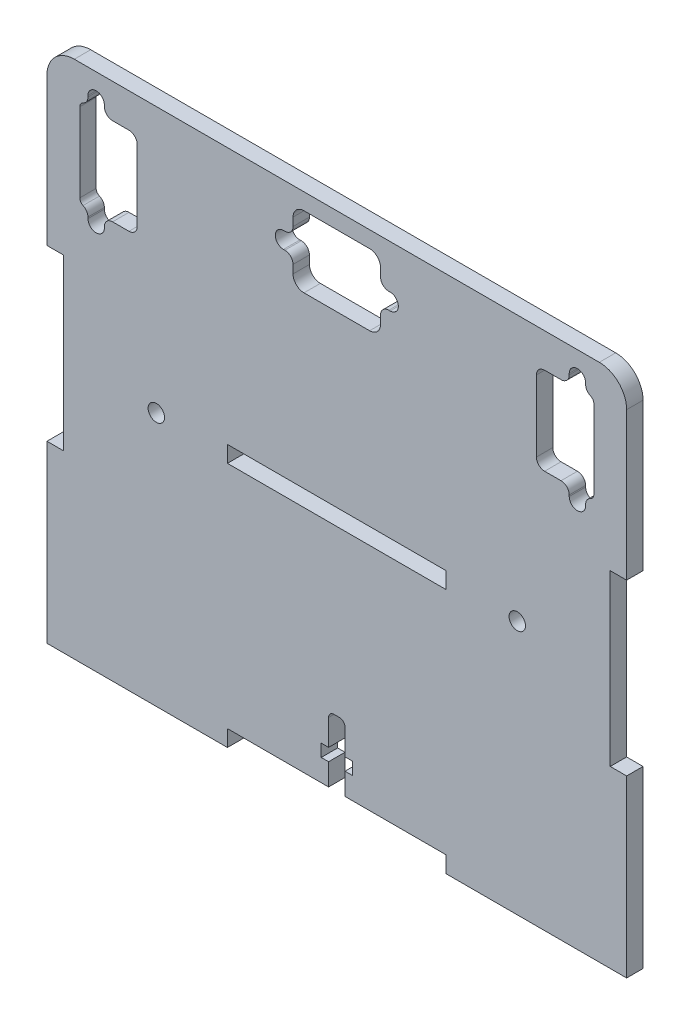
from build123d import *

# Parameters (mm, degrees)
ESBO_O1_W                = 100
ESBO_O1_H                = 95
RESSALTO_EXTRUS_O1_DEPTH = 1.5
ESBO_O2_R                = 1.5
ESBO_O2_W                = 40
ESBO_O2_H                = 3
CORTE_EXTRUS_O1_DEPTH    = 70.030790232
ESBO_O3_W                = 3
ESBO_O3_H                = 32
RESSALTO_EXTRUS_O2_DEPTH = 3
CUT_EXTRUDE1_DEPTH       = 72.233770081
CUT_EXTRUDE1_DEPTH_BACK  = 72.233770081
CUT_EXTRUDE4_DEPTH       = 72.186375101
CUT_EXTRUDE4_DEPTH_BACK  = 72.186375101
FILLET1_R                = 5


with BuildPart() as part:
    # Esboço1 → Ressalto-extrusão1 (new, symmetric)
    with BuildSketch(Plane.XY):
        Rectangle(ESBO_O1_W, ESBO_O1_H)
    extrude(amount=RESSALTO_EXTRUS_O1_DEPTH, both=True)

    # Esboço2 → Corte-extrusão1 (cut, through all)
    with BuildSketch(Plane.XY.offset(1.5)):
        with Locations((-33, -1)):
            Circle(ESBO_O2_R)
        with Locations(Location((33, -1, 0), (0, 0, 180))):
            Circle(ESBO_O2_R)
        with Locations((0, -46)):
            Rectangle(ESBO_O2_W, ESBO_O2_H)
        with Locations((0, -1)):
            Rectangle(ESBO_O2_W, ESBO_O2_H)
    extrude(amount=-CORTE_EXTRUS_O1_DEPTH, mode=Mode.SUBTRACT)

    # Esboço3 → Ressalto-extrusão2 (add, through all)
    with BuildSketch(Plane.XY.offset(1.5)):
        with Locations((-51.5, -31.5)):
            Rectangle(ESBO_O3_W, ESBO_O3_H)
        with Locations((51.5, -31.5)):
            Rectangle(ESBO_O3_W, ESBO_O3_H)
        with Locations((-51.5, 31.5)):
            Rectangle(ESBO_O3_W, ESBO_O3_H)
        with Locations((51.5, 31.5)):
            Rectangle(ESBO_O3_W, ESBO_O3_H)
    extrude(amount=-RESSALTO_EXTRUS_O2_DEPTH)

    # Sketch1 → Cut-Extrude1 (cut, two sides: drawn at the far end of the back side and taken through both)
    with BuildSketch(Plane(origin=(0, 0, -1.5), x_dir=(-1, 0, 0), z_dir=(0, 0, -1)).offset(-CUT_EXTRUDE1_DEPTH_BACK)):
        with BuildLine():
            Line((-36.5, 39.75), (-36.5, 26.75))
            ThreePointArc((-36.5, 26.75), (-36.939339828, 25.689339828), (-38, 25.25))
            Line((-38, 25.25), (-41, 25.25))
            ThreePointArc((-41, 25.25), (-42.060660172, 24.810660172), (-42.5, 23.75))
            Line((-42.5, 23.75), (-42.5, 23.5))
            ThreePointArc((-42.5, 23.5), (-44, 22), (-45.5, 23.5))
            Line((-45.5, 23.5), (-45.5, 23.75))
            ThreePointArc((-45.5, 23.75), (-45.74500996, 24.571583836), (-46.4, 25.124772708))
            ThreePointArc((-46.4, 25.124772708), (-46.836660027, 25.49356529), (-47, 26.041287847))
            Line((-47, 26.041287847), (-47, 40.458712153))
            ThreePointArc((-47, 40.458712153), (-46.836660027, 41.00643471), (-46.4, 41.375227292))
            ThreePointArc((-46.4, 41.375227292), (-45.74500996, 41.928416164), (-45.5, 42.75))
            Line((-45.5, 42.75), (-45.5, 43))
            ThreePointArc((-45.5, 43), (-44, 44.5), (-42.5, 43))
            Line((-42.5, 43), (-42.5, 42.75))
            ThreePointArc((-42.5, 42.75), (-42.060660172, 41.689339828), (-41, 41.25))
            Line((-41, 41.25), (-38, 41.25))
            ThreePointArc((-38, 41.25), (-36.939339828, 40.810660172), (-36.5, 39.75))
        make_face()
        with BuildLine():
            Line((-6, 44.5), (6, 44.5))
            ThreePointArc((6, 44.5), (7.414213562, 43.914213562), (8, 42.5))
            Line((8, 42.5), (8, 41))
            ThreePointArc((8, 41), (8.439339828, 39.939339828), (9.5, 39.5))
            Line((9.5, 39.5), (9.75, 39.5))
            ThreePointArc((9.75, 39.5), (11.25, 38), (9.75, 36.5))
            Line((9.75, 36.5), (9.5, 36.5))
            ThreePointArc((9.5, 36.5), (8.439339828, 36.060660172), (8, 35))
            Line((8, 35), (8, 33.5))
            ThreePointArc((8, 33.5), (7.414213562, 32.085786438), (6, 31.5))
            Line((6, 31.5), (-6, 31.5))
            ThreePointArc((-6, 31.5), (-7.414213562, 32.085786438), (-8, 33.5))
            Line((-8, 33.5), (-8, 35))
            ThreePointArc((-8, 35), (-8.439339828, 36.060660172), (-9.5, 36.5))
            Line((-9.5, 36.5), (-9.75, 36.5))
            ThreePointArc((-9.75, 36.5), (-11.25, 38), (-9.75, 39.5))
            Line((-9.75, 39.5), (-9.5, 39.5))
            ThreePointArc((-9.5, 39.5), (-8.439339828, 39.939339828), (-8, 41))
            Line((-8, 41), (-8, 42.5))
            ThreePointArc((-8, 42.5), (-7.414213562, 43.914213562), (-6, 44.5))
        make_face()
        with BuildLine():
            Line((47, 40.458712153), (47, 26.041287847))
            ThreePointArc((47, 26.041287847), (46.836660027, 25.49356529), (46.4, 25.124772708))
            ThreePointArc((46.4, 25.124772708), (45.74500996, 24.571583836), (45.5, 23.75))
            Line((45.5, 23.75), (45.5, 23.5))
            ThreePointArc((45.5, 23.5), (44, 22), (42.5, 23.5))
            Line((42.5, 23.5), (42.5, 23.75))
            ThreePointArc((42.5, 23.75), (42.060660172, 24.810660172), (41, 25.25))
            Line((41, 25.25), (38, 25.25))
            ThreePointArc((38, 25.25), (36.939339828, 25.689339828), (36.5, 26.75))
            Line((36.5, 26.75), (36.5, 39.75))
            ThreePointArc((36.5, 39.75), (36.939339828, 40.810660172), (38, 41.25))
            Line((38, 41.25), (41, 41.25))
            ThreePointArc((41, 41.25), (42.060660172, 41.689339828), (42.5, 42.75))
            Line((42.5, 42.75), (42.5, 43))
            ThreePointArc((42.5, 43), (44, 44.5), (45.5, 43))
            Line((45.5, 43), (45.5, 42.75))
            ThreePointArc((45.5, 42.75), (45.74500996, 41.928416164), (46.4, 41.375227292))
            ThreePointArc((46.4, 41.375227292), (46.836660027, 41.00643471), (47, 40.458712153))
        make_face()
    extrude(amount=CUT_EXTRUDE1_DEPTH + CUT_EXTRUDE1_DEPTH_BACK, mode=Mode.SUBTRACT)

    # Sketch2 → Cut-Extrude4 (cut, two sides: drawn at the far end of the back side and taken through both)
    with BuildSketch(Plane.XY.offset(-CUT_EXTRUDE4_DEPTH_BACK)):
        with BuildLine():
            Line((-0.5, -32.5), (0.5, -32.5))
            ThreePointArc((0.5, -32.5), (1.207106781, -32.792893219), (1.5, -33.5))
            Line((1.5, -33.5), (1.5, -38.23))
            Line((1.5, -38.23), (2.85, -38.23))
            Line((2.85, -38.23), (2.85, -40.5))
            Line((2.85, -40.5), (1.5, -40.5))
            Line((1.5, -40.5), (1.5, -44.5))
            Line((1.5, -44.5), (-1.5, -44.5))
            Line((-1.5, -44.5), (-1.5, -40.5))
            Line((-1.5, -40.5), (-2.85, -40.5))
            Line((-2.85, -40.5), (-2.85, -38.23))
            Line((-2.85, -38.23), (-1.5, -38.23))
            Line((-1.5, -38.23), (-1.5, -33.5))
            ThreePointArc((-1.5, -33.5), (-1.207106781, -32.792893219), (-0.5, -32.5))
        make_face()
    extrude(amount=CUT_EXTRUDE4_DEPTH + CUT_EXTRUDE4_DEPTH_BACK, mode=Mode.SUBTRACT)

    # Fillet1
    fillet1_edges = [part.edges().sort_by_distance(p)[0] for p in [
        (53, 47.5, 0),
        (-53, 47.5, 0),
    ]]
    fillet(fillet1_edges, radius=FILLET1_R)


solid = part.part
